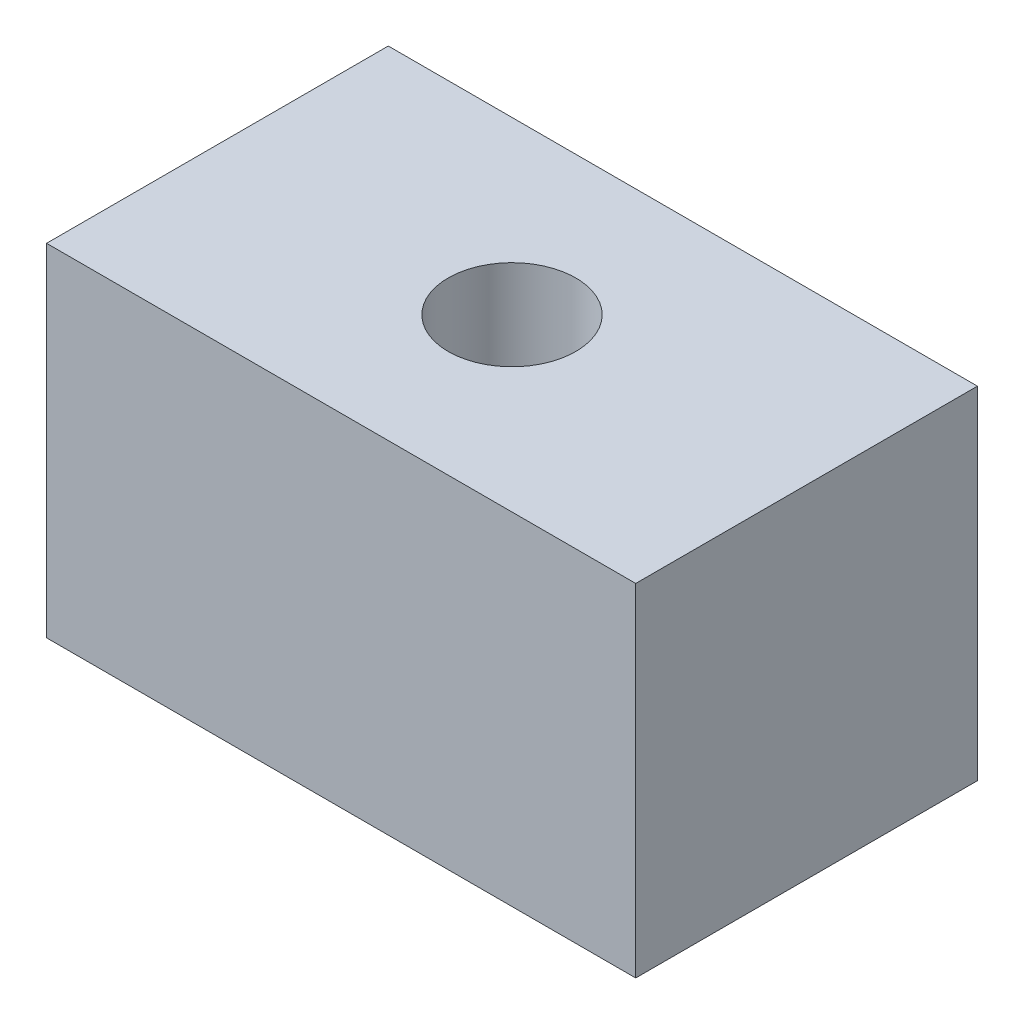
from build123d import *

# Parameters (mm, degrees)
SKETCH1_W           = 14.732
SKETCH1_H           = 14.732
BOSS_EXTRUDE1_DEPTH = 25.4
SKETCH2_R           = 2.75
CUT_EXTRUDE1_DEPTH  = 31.272921564
SKETCH3_W           = 10
SKETCH3_H           = 6.858
SKETCH3_R           = 1.5875
CUT_EXTRUDE2_DEPTH  = 1.778
FILLET1_R           = 0.79375


with BuildPart() as part:
    # Sketch1 → Boss-Extrude1 (new body)
    with BuildSketch(Plane(origin=(0, 0, 0), x_dir=(0, 0, -1), z_dir=(1, 0, 0))):
        Rectangle(SKETCH1_W, SKETCH1_H)
    extrude(amount=BOSS_EXTRUDE1_DEPTH)

    # Sketch2 → Cut-Extrude1 (cut, through all)
    with BuildSketch(Plane(origin=(0, 7.366, 0), x_dir=(1, 0, 0), z_dir=(0, 1, 0))):
        with Locations(Location((12.7, 0, 0), (0, 0, 270))):
            Circle(SKETCH2_R)
    extrude(amount=-CUT_EXTRUDE1_DEPTH, mode=Mode.SUBTRACT)

    # Sketch3 → Cut-Extrude2 (cut)
    with BuildSketch(Plane(origin=(0, 0, -7.366), x_dir=(-1, 0, 0), z_dir=(0, 0, -1))):
        with Locations((-5, -0.063)):
            Rectangle(SKETCH3_W, SKETCH3_H)
        with Locations(Location((-4.92, -0.063, 0), (0, 0, 90))):
            Circle(SKETCH3_R, mode=Mode.SUBTRACT)
    extrude(amount=-CUT_EXTRUDE2_DEPTH, mode=Mode.SUBTRACT)

    # Fillet1
    fillet1_edges = [part.edges().sort_by_distance(p)[0] for p in [
        (10, -3.492, -6.477),
        (10, 3.366, -6.477),
    ]]
    fillet(fillet1_edges, radius=FILLET1_R)


solid = part.part
